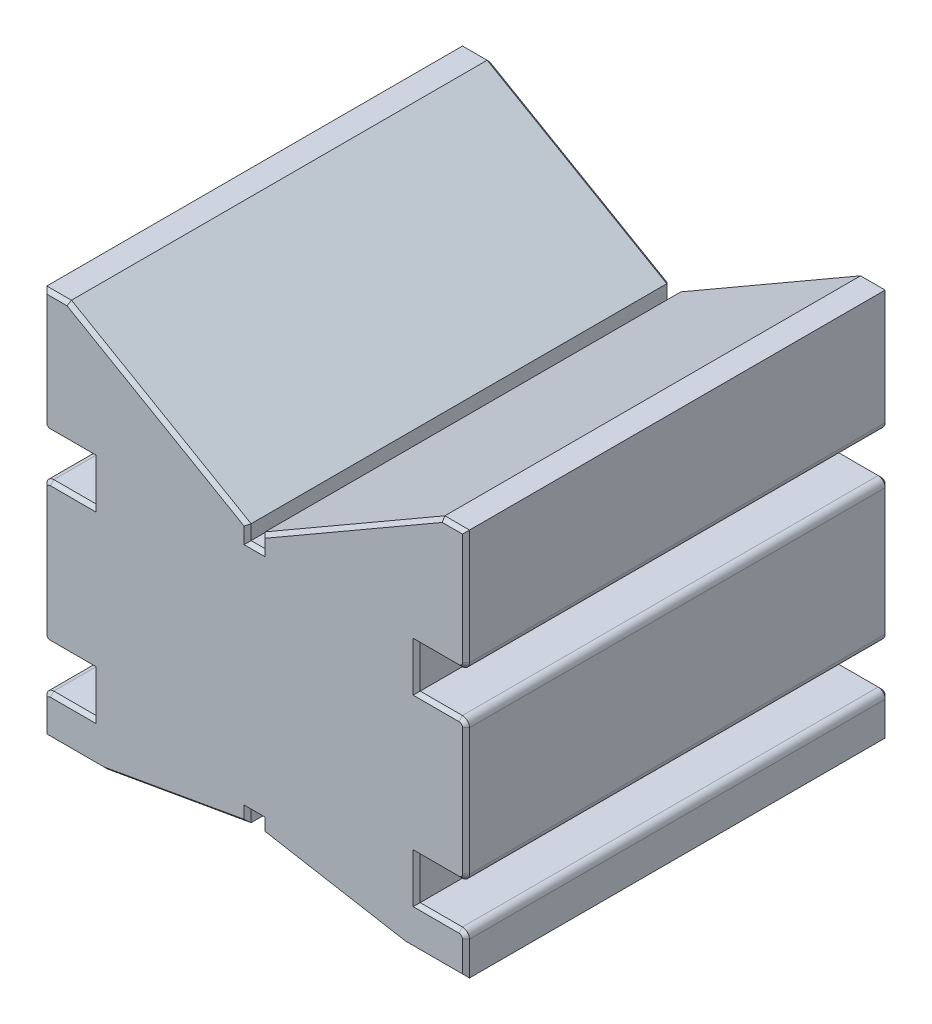
from build123d import *

# Parameters (mm, degrees)
BOSS_EXTRUDE1_DEPTH = 60
SKETCH3_W           = 2
SKETCH3_H           = 3
CUT_EXTRUDE1_DEPTH  = 73.601820229
CHAMFER1_SIZE       = 0.5


with BuildPart() as part:
    # Sketch1 → Boss-Extrude1 (new body)
    with BuildSketch(Plane.XY):
        with BuildLine():
            Line((-30, 0), (-30, 3))
            ThreePointArc((-30, 3), (-29.707106781, 3.707106781), (-29, 4))
            Line((-29, 4), (-23, 4))
            Line((-23, 4), (-23, 10))
            Line((-23, 10), (-29, 10))
            ThreePointArc((-29, 10), (-29.707106781, 10.292893219), (-30, 11))
            Line((-30, 11), (-30, 27.299782134))
            Line((-30, 27.299782134), (-26.5, 27.299782134))
            Line((-26.5, 27.299782134), (0, 12))
            Line((0, 12), (26.5, 27.299782134))
            Line((26.5, 27.299782134), (30, 27.299782134))
            Line((30, 27.299782134), (30, 11))
            ThreePointArc((30, 11), (29.707106781, 10.292893219), (29, 10))
            Line((29, 10), (23, 10))
            Line((23, 10), (23, 4))
            Line((23, 4), (29, 4))
            ThreePointArc((29, 4), (29.707106781, 3.707106781), (30, 3))
            Line((30, 3), (30, 0))
            Line((30, 0), (30, -15))
            ThreePointArc((30, -15), (29.707106781, -15.707106781), (29, -16))
            Line((29, -16), (23, -16))
            Line((23, -16), (23, -22))
            Line((23, -22), (29, -22))
            ThreePointArc((29, -22), (29.707106781, -22.292893219), (30, -23))
            Line((30, -23), (30, -27.767324332))
            Line((30, -27.767324332), (21.36555799, -27.767324332))
            Line((21.36555799, -27.767324332), (0, -24))
            Line((0, -24), (-21.36555799, -27.767324332))
            Line((-21.36555799, -27.767324332), (-30, -27.767324332))
            Line((-30, -27.767324332), (-30, -23))
            ThreePointArc((-30, -23), (-29.707106781, -22.292893219), (-29, -22))
            Line((-29, -22), (-23, -22))
            Line((-23, -22), (-23, -16))
            Line((-23, -16), (-29, -16))
            ThreePointArc((-29, -16), (-29.707106781, -15.707106781), (-30, -15))
            Line((-30, -15), (-30, 0))
        make_face()
    extrude(amount=BOSS_EXTRUDE1_DEPTH)

    # Sketch3 → Cut-Extrude1 (cut, through all)
    with BuildSketch(Plane(origin=(0, 0, 0), x_dir=(-1, 0, 0), z_dir=(0, 0, -1))):
        with Locations((0, 12)):
            Rectangle(SKETCH3_W, SKETCH3_H)
        with Locations((0, -24)):
            Rectangle(SKETCH3_W, SKETCH3_H)
    extrude(amount=-CUT_EXTRUDE1_DEPTH, mode=Mode.SUBTRACT)

    # Chamfer1
    chamfer1_edges = [part.edges().sort_by_distance(p)[0] for p in [
        (-29.707106781, 3.707106781, 60),
        (-26, 4, 60),
        (-23, 7, 60),
        (-26, 10, 60),
        (-29.707106781, 10.292893219, 60),
        (-30, 19.149891067, 60),
        (-28.25, 27.299782134, 60),
        (-13.75, 19.938566201, 60),
        (13.75, 19.938566201, 60),
        (28.25, 27.299782134, 60),
        (30, 19.149891067, 60),
        (29.707106781, 10.292893219, 60),
        (26, 10, 60),
        (23, 7, 60),
        (26, 4, 60),
        (29.707106781, 3.707106781, 60),
        (30, -6, 60),
        (29.707106781, -15.707106781, 60),
        (26, -16, 60),
        (23, -19, 60),
        (26, -22, 60),
        (29.707106781, -22.292893219, 60),
        (30, -25.383662166, 60),
        (25.682778995, -27.767324332, 60),
        (11.182778995, -25.971825656, 60),
        (-11.182778995, -25.971825656, 60),
        (-25.682778995, -27.767324332, 60),
        (-30, -25.383662166, 60),
        (-29.707106781, -22.292893219, 60),
        (-26, -22, 60),
        (-23, -19, 60),
        (-26, -16, 60),
        (-29.707106781, -15.707106781, 60),
        (-30, -6, 60),
        (-26, -16, 0),
        (-23, -19, 0),
        (-26, -22, 0),
        (-29.707106781, -22.292893219, 0),
        (-30, -25.383662166, 0),
        (-25.682778995, -27.767324332, 0),
        (-11.182778995, -25.971825656, 0),
        (11.182778995, -25.971825656, 0),
        (25.682778995, -27.767324332, 0),
        (30, -25.383662166, 0),
        (29.707106781, -22.292893219, 0),
        (26, -22, 0),
        (23, -19, 0),
        (26, -16, 0),
        (29.707106781, -15.707106781, 0),
        (30, -6, 0),
        (29.707106781, 3.707106781, 0),
        (26, 4, 0),
        (23, 7, 0),
        (26, 10, 0),
        (29.707106781, 10.292893219, 0),
        (30, 19.149891067, 0),
        (28.25, 27.299782134, 0),
        (13.75, 19.938566201, 0),
        (-13.75, 19.938566201, 0),
        (-28.25, 27.299782134, 0),
        (-30, 19.149891067, 0),
        (-29.707106781, 10.292893219, 0),
        (-26, 10, 0),
        (-23, 7, 0),
        (-26, 4, 0),
        (-29.707106781, 3.707106781, 0),
        (-30, -6, 0),
        (-29.707106781, -15.707106781, 0),
        (1, -23.33816349, 60),
        (0, -22.5, 60),
        (-1, -23.33816349, 60),
        (-1, 11.538675135, 60),
        (0, 10.5, 60),
        (1, 11.538675135, 60),
        (-1, 11.538675135, 0),
        (-1, -23.33816349, 0),
        (0, -22.5, 0),
        (1, -23.33816349, 0),
        (1, 11.538675135, 0),
        (0, 10.5, 0),
    ]]
    chamfer(chamfer1_edges, length=CHAMFER1_SIZE)


solid = part.part
